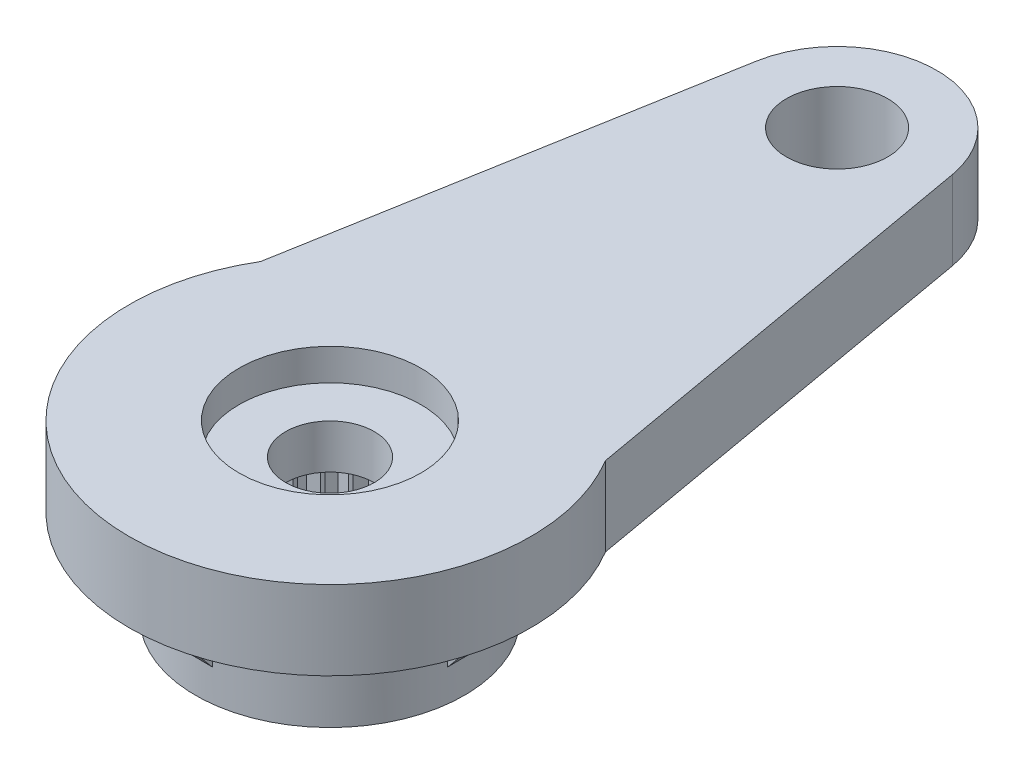
from build123d import *

# Parameters (mm, degrees)
BASES_R             = 6.35
BASE_DEPTH          = 5.4
TOPBORES_R          = 1.4
TOP_BORE_DEPTH      = 11.478788098
HORN_START          = -2.5
HORN_HALF_DEPTH     = 2.5
HORNATTACHS_R       = 1.6
HORN_ATTACH_DEPTH   = 21.913031822
TOOTH_DEPTH         = 3
TOOTH_CP_COUNT      = 26
BOTTOMBORES_R       = 2.6
BOTTOM_BORE_DEPTH   = 3
HOLDINGSHAFTS_R     = 6.35
HOLDINGSHAFTS_R_2   = 4.25
HOLDING_SHAFT_DEPTH = 2.9
RIB_DEPTH           = 0.5
RIB_CP_COUNT        = 4
SKETCH1_R           = 2.875
CUT_EXTRUDE1_DEPTH  = 1


with BuildPart() as part:
    # BaseS → BASE (new body)
    with BuildSketch(Plane(origin=(0, 0, 0), x_dir=(1, 0, 0), z_dir=(0, 1, 0))):
        with Locations(Location((0, 0, 0), (0, 0, 90))):
            Circle(BASES_R)
    extrude(amount=BASE_DEPTH)

    # TopBoreS → TOP BORE (cut, through all)
    with BuildSketch(Plane(origin=(0, 5.4, 0), x_dir=(1, 0, 0), z_dir=(0, 1, 0))):
        with Locations(Location((0, 0, 0), (0, 0, 270))):
            Circle(TOPBORES_R)
    extrude(amount=-TOP_BORE_DEPTH, mode=Mode.SUBTRACT)

    # HornHalfS → HORN HALF (add)
    with BuildSketch(Plane(origin=(0, 5.4, 0), x_dir=(1, 0, 0), z_dir=(0, 1, 0)).offset(HORN_START)):
        with BuildLine():
            Line((-3.102144422, 16.57699176), (-5.450702003, 3.257659846))
            ThreePointArc((-5.450702003, 3.257659846), (0, 6.35), (5.450702003, 3.257659846))
            Line((5.450702003, 3.257659846), (3.102144422, 16.57699176))
            ThreePointArc((3.102144422, 16.57699176), (0, 19.18), (-3.102144422, 16.57699176))
        make_face()
    extrude(amount=HORN_HALF_DEPTH)

    # HornAttachS → HORN ATTACH (cut, through all)
    with BuildSketch(Plane(origin=(0, 5.4, 0), x_dir=(1, 0, 0), z_dir=(0, 1, 0))):
        with Locations(Location((0, 16.03, 0), (0, 0, 270))):
            Circle(HORNATTACHS_R)
    extrude(amount=-HORN_ATTACH_DEPTH, mode=Mode.SUBTRACT)

    # ToothS → TOOTH (cut)
    with BuildSketch(Plane.XZ):
        with BuildLine():
            Line((0, -2.9), (0.262912611, -2.586672952))
            ThreePointArc((0.262912611, -2.586672952), (0, -2.6), (-0.262912611, -2.586672952))
            Line((-0.262912611, -2.586672952), (0, -2.9))
        make_face()
    tooth = extrude(amount=-TOOTH_DEPTH, mode=Mode.SUBTRACT)

    # TOOTH CP: TOOTH ×26 about axis
    tooth_cp_axis = Axis((0, 0, 0), (0, 1, 0))
    for i in range(1, TOOTH_CP_COUNT):
        add(tooth.rotate(tooth_cp_axis, i * 360 / TOOTH_CP_COUNT), mode=Mode.SUBTRACT)

    # BottomBoreS → BOTTOM BORE (cut)
    with BuildSketch(Plane(origin=(0, 0, 0), x_dir=(-1, 0, 0), z_dir=(0, -1, 0))):
        Circle(BOTTOMBORES_R)
    extrude(amount=-BOTTOM_BORE_DEPTH, mode=Mode.SUBTRACT)

    # HoldingShaftS → HOLDING SHAFT (cut)
    with BuildSketch(Plane.XZ):
        Circle(HOLDINGSHAFTS_R)
        with Locations(Location((0, 0, 0), (0, 0, 270))):
            Circle(HOLDINGSHAFTS_R_2, mode=Mode.SUBTRACT)
    extrude(amount=-HOLDING_SHAFT_DEPTH, mode=Mode.SUBTRACT)

    # RibS → RIB (add, symmetric)
    with BuildSketch(Plane.XY):
        Polygon((4.21, 1), (5.804289299, 2.9), (4.21, 2.9), (4.16, 2.9), (4.16, 1), align=None)
    rib = extrude(amount=RIB_DEPTH, both=True)

    # RIB CP: RIB ×4 about axis
    rib_cp_axis = Axis((0, 0, 0), (0, 1, 0))
    for i in range(1, RIB_CP_COUNT):
        add(rib.rotate(rib_cp_axis, i * 360 / RIB_CP_COUNT))

    # Sketch1 → Cut-Extrude1 (cut)
    with BuildSketch(Plane(origin=(0, 5.4, 0), x_dir=(1, 0, 0), z_dir=(0, 1, 0))):
        with Locations(Location((0, 0, 0), (0, 0, 270))):
            Circle(SKETCH1_R)
    extrude(amount=-CUT_EXTRUDE1_DEPTH, mode=Mode.SUBTRACT)


solid = part.part
